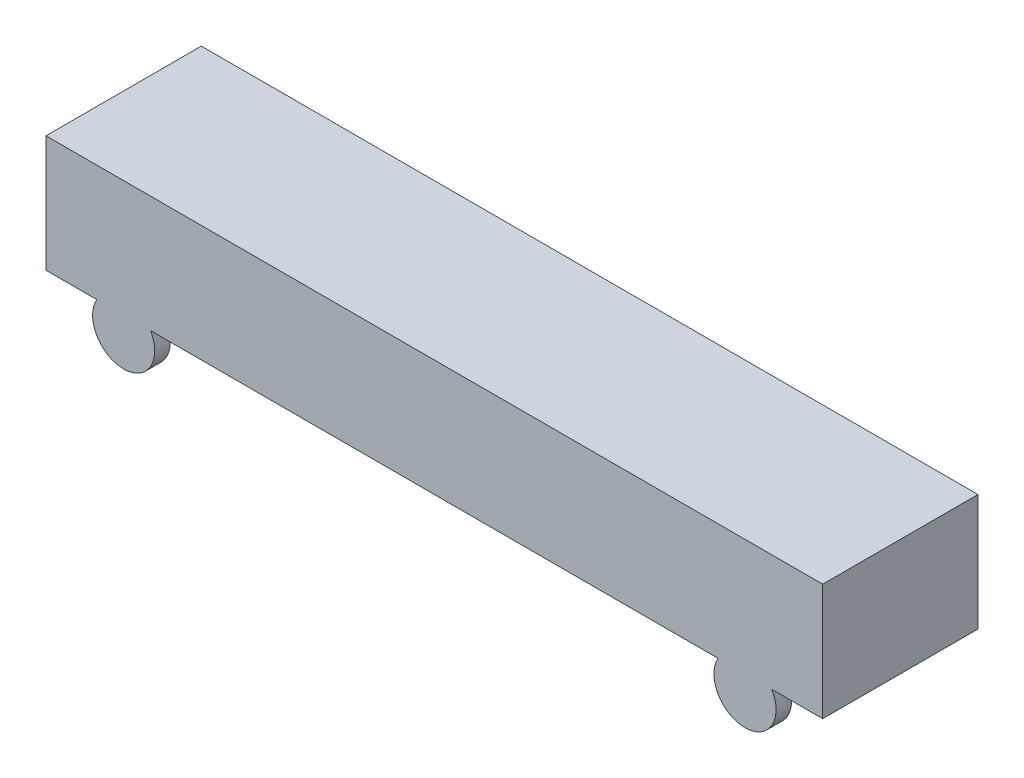
from build123d import *

# Parameters (mm, degrees)
EXTRUDE_1_DEPTH      = 1
EXTRUDE_1_DEPTH_BACK = 1
SKETCH_1_W           = 10
SKETCH_1_H           = 1.5
SKETCH_2_R           = 0.4
EXTRUDE_2_DEPTH      = 0.2


with BuildPart() as part:
    # 草图1 → 凸台-拉伸1 (new, two sides: drawn at the far end of the back side and taken through both)
    with BuildSketch(Plane.XY.offset(-EXTRUDE_1_DEPTH_BACK)):
        with Locations((5, 0.75)):
            Rectangle(SKETCH_1_W, SKETCH_1_H)
    extrude(amount=EXTRUDE_1_DEPTH + EXTRUDE_1_DEPTH_BACK)

    # 草图2 → 凸台-拉伸2 (add)
    with BuildSketch(Plane.XY.offset(1)):
        with Locations((9, -0.2)):
            Circle(SKETCH_2_R)
        with Locations((1, -0.2)):
            Circle(SKETCH_2_R)
    extrude_2 = extrude(amount=-EXTRUDE_2_DEPTH)

    # 镜向1: 凸台-拉伸2 across plane
    add(extrude_2.mirror(Plane.XY))


solid = part.part
